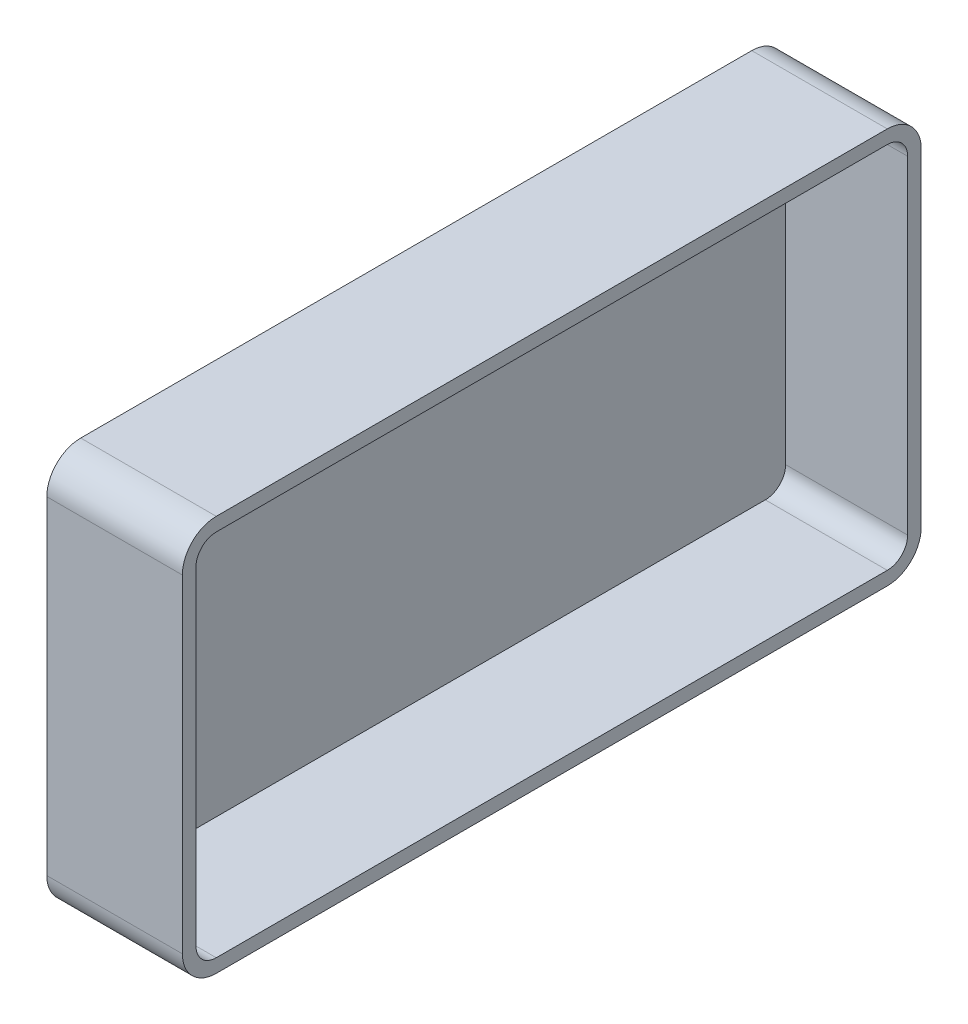
from build123d import *

# Parameters (mm, degrees)
BOSS_EXTRUDE1_DEPTH = 20
SHELL1_T            = -2


with BuildPart() as part:
    # Sketch1 → Boss-Extrude1 (new body)
    with BuildSketch(Plane(origin=(0, 0, 0), x_dir=(0, 0, -1), z_dir=(1, 0, 0))):
        with BuildLine():
            Line((-49.5, -29.2), (49.5, -29.2))
            ThreePointArc((49.5, -29.2), (53.035533906, -27.735533906), (54.5, -24.2))
            Line((54.5, -24.2), (54.5, 24.2))
            ThreePointArc((54.5, 24.2), (53.035533906, 27.735533906), (49.5, 29.2))
            Line((49.5, 29.2), (-49.5, 29.2))
            ThreePointArc((-49.5, 29.2), (-53.035533906, 27.735533906), (-54.5, 24.2))
            Line((-54.5, 24.2), (-54.5, -24.2))
            ThreePointArc((-54.5, -24.2), (-53.035533906, -27.735533906), (-49.5, -29.2))
        make_face()
    extrude(amount=BOSS_EXTRUDE1_DEPTH)

    # Shell1
    shell1_openings = [part.faces().sort_by_distance(p)[0] for p in [
        (20, 0, 0),
    ]]
    offset(amount=SHELL1_T, openings=shell1_openings, kind=Kind.INTERSECTION)


solid = part.part
